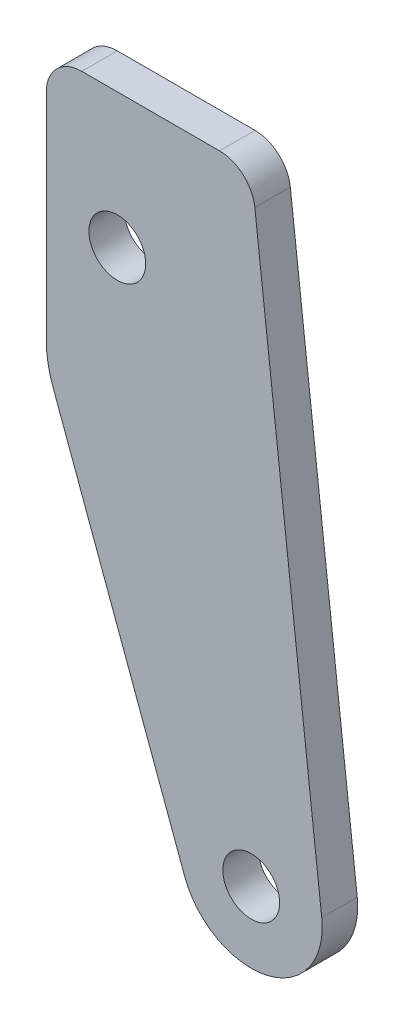
from build123d import *

# Parameters (mm, degrees)
SZKIC1_R                    = 20
SZKIC1_R_2                  = 8
DODANIE_WYCI_GNI_CIE3_DEPTH = 10


with BuildPart() as part:
    # Szkic1 → Dodanie-wyciągnięcie3 (new body)
    # profile 1 of 3: a face of its own
    with BuildSketch(Plane.XY):
        with BuildLine():
            ThreePointArc((-57.25630176, 99), (-56.682391116, 96.462784094), (-55.890841639, 93.984823763))
            Line((-55.890841639, 93.984823763), (-18.769836395, -6.906029373))
            ThreePointArc((-18.769836395, -6.906029373), (-4.628612665, 19.457028159), (19.868958458, 2.285714286))
            Line((19.868958458, 2.285714286), (1.018920947, 166.142857143))
            ThreePointArc((1.018920947, 166.142857143), (-2.260807026, 172.464200273), (-8.915558282, 175))
            Line((-8.915558282, 175), (-17.736087047, 175))
            Line((-17.736087047, 175), (-17.736087047, 99))
            Line((-17.736087047, 99), (-57.25630176, 99))
        make_face()
    # profile 2 of 3: a face of its own
    with BuildSketch(Plane.XY):
        Circle(SZKIC1_R)
        Circle(SZKIC1_R_2, mode=Mode.SUBTRACT)
    # profile 3 of 3: a face of its own
    with BuildSketch(Plane.XY):
        with BuildLine():
            ThreePointArc((-57.736087047, 104.343867823), (-57.615899976, 101.661186457), (-57.25630176, 99))
            Line((-57.25630176, 99), (-17.736087047, 99))
            Line((-17.736087047, 99), (-17.736087047, 175))
            Line((-17.736087047, 175), (-47.736087047, 175))
            ThreePointArc((-47.736087047, 175), (-54.807154859, 172.071067812), (-57.736087047, 165))
            Line((-57.736087047, 165), (-57.736087047, 104.343867823))
        make_face()
        with Locations((-37.736087047, 137)):
            Circle(SZKIC1_R_2, mode=Mode.SUBTRACT)
    extrude(amount=DODANIE_WYCI_GNI_CIE3_DEPTH)


solid = part.part
